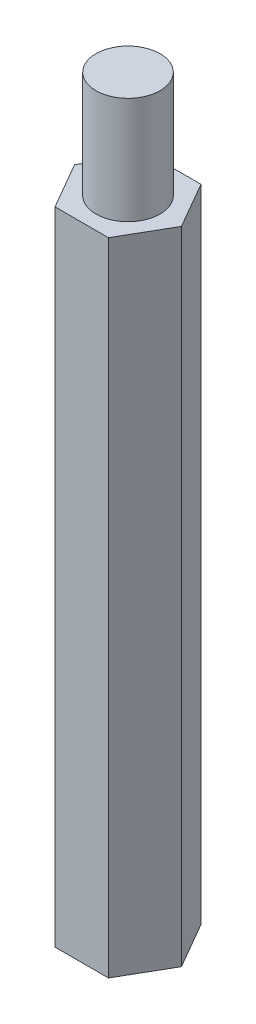
from build123d import *

# Parameters (mm, degrees)
EXTRUDE_1_DEPTH     = 30
SKETCH_2_R          = 1.5
EXTRUDE_2_DEPTH     = 5
SKETCH_3_R          = 1.5
CUT_EXTRUDE_1_DEPTH = 10


with BuildPart() as part:
    # Эскиз1 → Бобышка-Вытянуть1 (new body)
    with BuildSketch(Plane(origin=(0, 0, 0), x_dir=(1, 0, 0), z_dir=(0, 1, 0))):
        Polygon((1.25, -2.165063509), (2.5, 0), (1.25, 2.165063509), (-1.25, 2.165063509), (-2.5, 0), (-1.25, -2.165063509), align=None)
    extrude(amount=EXTRUDE_1_DEPTH)

    # Эскиз2 → Бобышка-Вытянуть2 (add)
    with BuildSketch(Plane(origin=(0, 30, 0), x_dir=(1, 0, 0), z_dir=(0, 1, 0))):
        with Locations(Location((0, 0, 0), (0, 0, 270))):
            Circle(SKETCH_2_R)
    extrude(amount=EXTRUDE_2_DEPTH)

    # Эскиз3 → Вырез-Вытянуть1 (cut)
    with BuildSketch(Plane.XZ):
        with Locations(Location((0, 0, 0), (0, 0, 90))):
            Circle(SKETCH_3_R)
    extrude(amount=-CUT_EXTRUDE_1_DEPTH, mode=Mode.SUBTRACT)


solid = part.part
